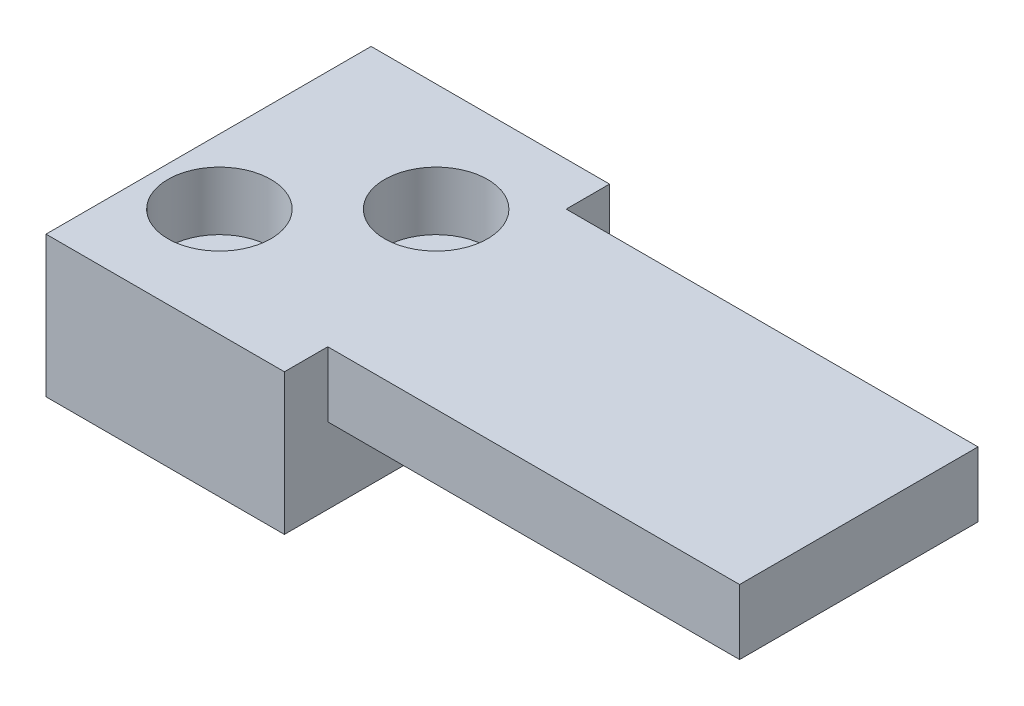
from build123d import *

# Parameters (mm, degrees)
ESBO_O1_W                  = 38
ESBO_O1_H                  = 6
RESSALTO_EXTRUS_O1_DEPTH   = 30
CORTE_EXTRUS_O1_DEPTH      = 69.330081223
CORTE_EXTRUS_O1_DEPTH_BACK = 69.330081223
ESBO_O2_W                  = 38
ESBO_O2_H                  = 4
CORTE_EXTRUS_O2_DEPTH      = 69.330081223
CORTE_EXTRUS_O2_DEPTH_BACK = 69.330081223
ESBO_O4_R                  = 2.75
ESBO_O5_R                  = 4.75
CORTE_EXTRUS_O3_DEPTH      = 5.4


with BuildPart() as part:
    # Esboço1 → Ressalto-extrusão1 (new body)
    with BuildSketch(Plane.XY):
        Polygon((22, 0), (0, 0), (0, -13), (22, -13), (22, -6), align=None)
        with Locations((41, -3)):
            Rectangle(ESBO_O1_W, ESBO_O1_H)
    extrude(amount=RESSALTO_EXTRUS_O1_DEPTH)

    # Esboço2 → Corte-extrusão1 (cut, two sides: drawn at the far end of the back side and taken through both)
    with BuildSketch(Plane(origin=(0, 0, 0), x_dir=(1, 0, 0), z_dir=(0, 1, 0)).offset(-CORTE_EXTRUS_O1_DEPTH_BACK)):
        with Locations((41, -2)):
            Rectangle(ESBO_O2_W, ESBO_O2_H)
        with Locations((41, -28)):
            Rectangle(ESBO_O2_W, ESBO_O2_H)
    extrude(amount=CORTE_EXTRUS_O1_DEPTH + CORTE_EXTRUS_O1_DEPTH_BACK, mode=Mode.SUBTRACT)

    # Esboço4 → Corte-extrusão2 (cut, two sides: drawn at the far end of the back side and taken through both)
    with BuildSketch(Plane(origin=(0, 0, 0), x_dir=(1, 0, 0), z_dir=(0, 1, 0)).offset(-CORTE_EXTRUS_O2_DEPTH_BACK)):
        with Locations(Location((6, -20, 0), (0, 0, 270))):
            Circle(ESBO_O4_R)
        with Locations(Location((16, -10, 0), (0, 0, 270))):
            Circle(ESBO_O4_R)
    extrude(amount=CORTE_EXTRUS_O2_DEPTH + CORTE_EXTRUS_O2_DEPTH_BACK, mode=Mode.SUBTRACT)

    # Esboço5 → Corte-extrusão3 (cut)
    with BuildSketch(Plane(origin=(0, 0, 0), x_dir=(1, 0, 0), z_dir=(0, 1, 0))):
        with Locations(Location((6, -20, 0), (0, 0, 270))):
            Circle(ESBO_O5_R)
        with Locations(Location((16, -10, 0), (0, 0, 270))):
            Circle(ESBO_O5_R)
    extrude(amount=-CORTE_EXTRUS_O3_DEPTH, mode=Mode.SUBTRACT)


solid = part.part
